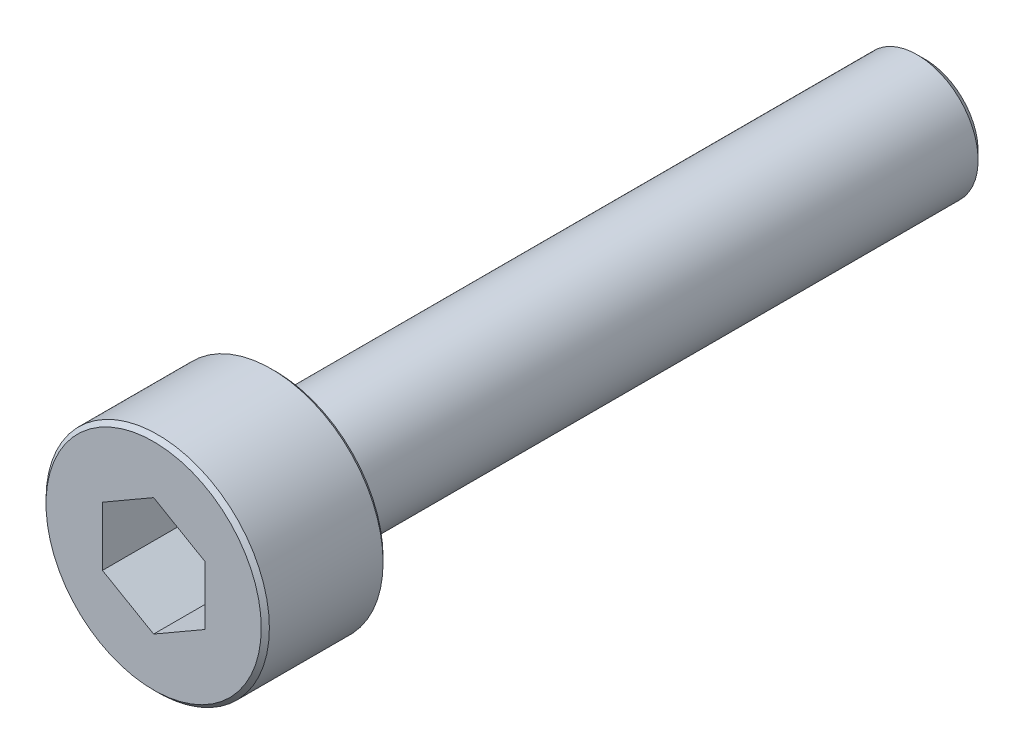
from build123d import *

# Parameters (mm, degrees)
SKETCH_1_W          = 2.75
SKETCH_1_H          = 3
SKETCH_2_R          = 1.5
EXTRUDE_1_DEPTH     = 16
CUT_EXTRUDE_1_DEPTH = 2.25
CHAMFER_1_SIZE2     = 0.100001315
CHAMFER_1_SIZE      = 0.100001264
CHAMFER_2_SIZE      = 0.200016533
CHAMFER_2_SIZE2     = 0.200019077


with BuildPart() as part:
    # 草图1 → 旋转1 (revolve)
    with BuildSketch(Plane(origin=(0, 0, 0), x_dir=(1, 0, 0), z_dir=(0, 1, 0))):
        with Locations((1.375, -17.5)):
            Rectangle(SKETCH_1_W, SKETCH_1_H)
    revolve(axis=Axis((0, 0, 16), (0, 0, 1)))

    # 草图2 → 凸台-拉伸1 (add)
    with BuildSketch(Plane(origin=(0, 0, 16), x_dir=(-1, 0, 0), z_dir=(0, 0, -1))):
        Circle(SKETCH_2_R)
    extrude(amount=EXTRUDE_1_DEPTH)

    # 草图3 → 切除-拉伸1 (cut)
    with BuildSketch(Plane.XY.offset(19)):
        Polygon((-1.26, -0.727461339), (0, -1.454922678), (1.26, -0.727461339), (1.26, 0.727461339), (0, 1.454922678), (-1.26, 0.727461339), align=None)
    extrude(amount=-CUT_EXTRUDE_1_DEPTH, mode=Mode.SUBTRACT)

    # 倒角1
    chamfer_1_edges = [part.edges().sort_by_distance(p)[0] for p in [
        (-2.75, 0, 19),
        (-2.75, 0, 16),
    ]]
    chamfer(chamfer_1_edges, length=CHAMFER_1_SIZE, length2=CHAMFER_1_SIZE2)

    # 倒角2
    chamfer_2_edges = [part.edges().sort_by_distance(p)[0] for p in [
        (1.5, 0, 0),
    ]]
    chamfer_2_side = [part.faces().sort_by_distance(p)[0] for p in [
        (1.5, 0, 8),
    ]]
    chamfer(chamfer_2_edges, length=CHAMFER_2_SIZE, length2=CHAMFER_2_SIZE2, reference=chamfer_2_side[0])


solid = part.part
